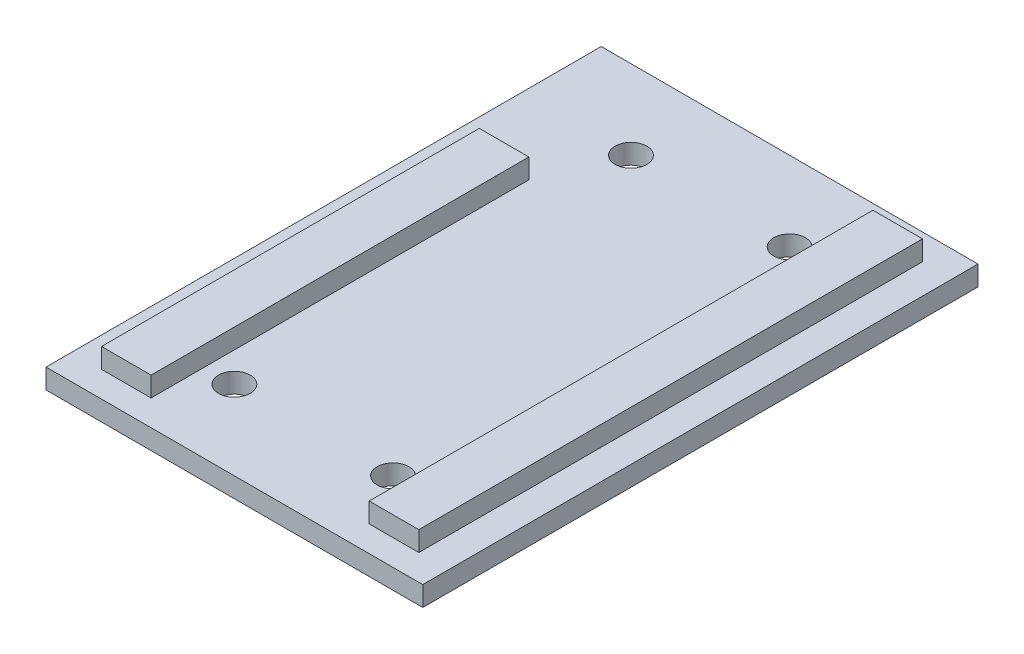
from build123d import *

# Parameters (mm, degrees)
SKETCH1_W                  = 38
SKETCH1_H                  = 56
BOSS_EXTRUDE1_DEPTH        = 2
SKETCH2_W                  = 5
SKETCH2_H                  = 38.1
SKETCH2_H_2                = 50.8
BOSS_EXTRUDE2_DEPTH        = 2
F_3_2_3_2_DIAMETER_HOLE1_D = 3.2


with BuildPart() as part:
    # Sketch1 → Boss-Extrude1 (new body)
    with BuildSketch(Plane(origin=(0, 0, 0), x_dir=(1, 0, 0), z_dir=(0, 1, 0))):
        Rectangle(SKETCH1_W, SKETCH1_H)
    extrude(amount=BOSS_EXTRUDE1_DEPTH)

    # Sketch2 → Boss-Extrude2 (add)
    with BuildSketch(Plane(origin=(0, 2, 0), x_dir=(1, 0, 0), z_dir=(0, 1, 0))):
        with Locations((-13.5, -6.35)):
            Rectangle(SKETCH2_W, SKETCH2_H)
        with Locations((13.5, 0)):
            Rectangle(SKETCH2_W, SKETCH2_H_2)
    extrude(amount=BOSS_EXTRUDE2_DEPTH)

    # Ø3.2 (3.2) Diameter Hole1 (through all)
    with Locations(Plane(origin=(0, 2, 0), x_dir=(1, 0, 0), z_dir=(0, 1, 0))):
        with Locations((-8, -20), (8, -20), (-8, 20), (8, 20)):
            Hole(F_3_2_3_2_DIAMETER_HOLE1_D / 2)


solid = part.part
